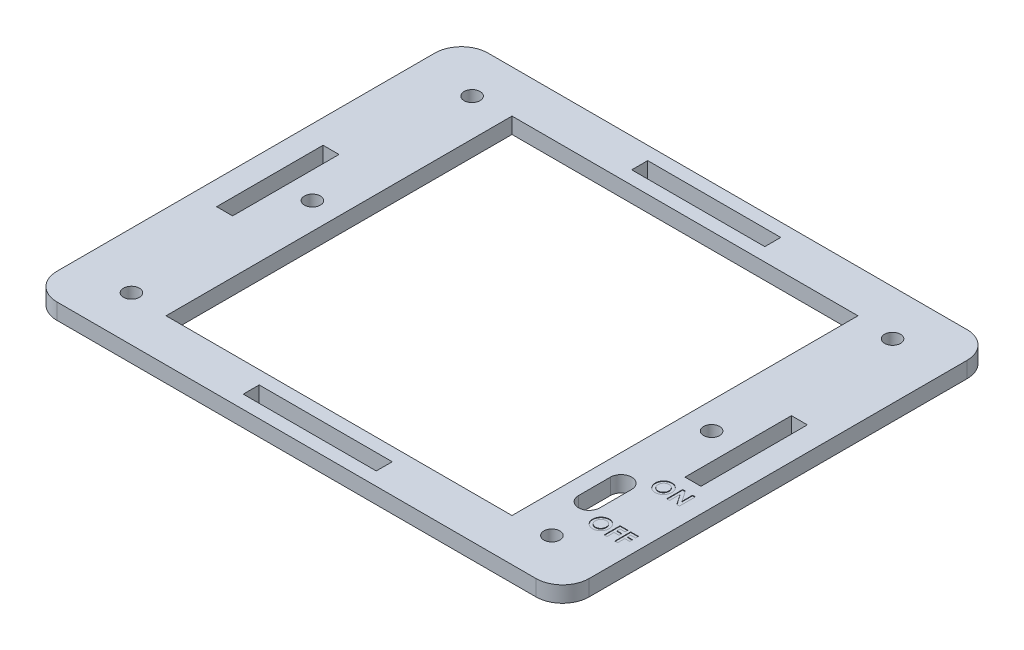
from build123d import *

# Parameters (mm, degrees)
SKETCH1_W           = 100
SKETCH1_H           = 81
BOSS_EXTRUDE1_DEPTH = 3
FILLET1_R           = 5
SKETCH2_R           = 1.5
CUT_EXTRUDE1_DEPTH  = 3
SKETCH3_W           = 25
SKETCH3_H           = 3
SKETCH3_W_2         = 3
SKETCH3_H_2         = 20
CUT_EXTRUDE2_DEPTH  = 10
SKETCH4_W           = 65
SKETCH4_H           = 65
CUT_EXTRUDE3_DEPTH  = 65.414672242
CUT_EXTRUDE4_DEPTH  = 6
SKETCH6_R           = 1.5
CUT_EXTRUDE5_DEPTH  = 3
CUT_EXTRUDE6_DEPTH  = 0.1


with BuildPart() as part:
    # Sketch1 → Boss-Extrude1 (new body)
    with BuildSketch(Plane(origin=(0, 0, 0), x_dir=(1, 0, 0), z_dir=(0, 1, 0))):
        Rectangle(SKETCH1_W, SKETCH1_H)
    extrude(amount=BOSS_EXTRUDE1_DEPTH)

    # Fillet1
    fillet1_edges = [part.edges().sort_by_distance(p)[0] for p in [
        (50, 1.5, 40.5),
        (-50, 1.5, 40.5),
        (-50, 1.5, -40.5),
        (50, 1.5, -40.5),
    ]]
    fillet(fillet1_edges, radius=FILLET1_R)

    # Sketch2 → Cut-Extrude1 (cut)
    with BuildSketch(Plane(origin=(0, 3, 0), x_dir=(1, 0, 0), z_dir=(0, 1, 0))):
        with Locations(Location((39.5, -32, 0), (0, 0, 270))):
            Circle(SKETCH2_R)
        with Locations(Location((39.5, 32, 0), (0, 0, 270))):
            Circle(SKETCH2_R)
        with Locations(Location((-39.5, 32, 0), (0, 0, 270))):
            Circle(SKETCH2_R)
        with Locations(Location((-39.5, -32, 0), (0, 0, 270))):
            Circle(SKETCH2_R)
    extrude(amount=-CUT_EXTRUDE1_DEPTH, mode=Mode.SUBTRACT)

    # Sketch3 → Cut-Extrude2 (cut)
    with BuildSketch(Plane(origin=(0, 3, 0), x_dir=(1, 0, 0), z_dir=(0, 1, 0))):
        with Locations((0, -36.5)):
            Rectangle(SKETCH3_W, SKETCH3_H)
        with Locations((0, 36.5)):
            Rectangle(SKETCH3_W, SKETCH3_H)
        with Locations((44, 0)):
            Rectangle(SKETCH3_W_2, SKETCH3_H_2)
        with Locations((-44, 0)):
            Rectangle(SKETCH3_W_2, SKETCH3_H_2)
    extrude(amount=-CUT_EXTRUDE2_DEPTH, mode=Mode.SUBTRACT)

    # Sketch4 → Cut-Extrude3 (cut, through all)
    with BuildSketch(Plane(origin=(0, 3, 0), x_dir=(1, 0, 0), z_dir=(0, 1, 0))):
        Rectangle(SKETCH4_W, SKETCH4_H)
    extrude(amount=-CUT_EXTRUDE3_DEPTH, mode=Mode.SUBTRACT)

    # Sketch5 → Cut-Extrude4 (cut)
    with BuildSketch(Plane(origin=(0, 3, 0), x_dir=(1, 0, 0), z_dir=(0, 1, 0))):
        with BuildLine():
            Line((39.5, -17), (39.5, -23))
            ThreePointArc((39.5, -23), (37.5, -25), (35.5, -23))
            Line((35.5, -23), (35.5, -17))
            ThreePointArc((35.5, -17), (37.5, -15), (39.5, -17))
        make_face()
    extrude(amount=-CUT_EXTRUDE4_DEPTH, mode=Mode.SUBTRACT)

    # Sketch6 → Cut-Extrude5 (cut)
    with BuildSketch(Plane(origin=(0, 3, 0), x_dir=(1, 0, 0), z_dir=(0, 1, 0))):
        with Locations(Location((-37.5, 0, 0), (0, 0, 270))):
            Circle(SKETCH6_R)
        with Locations(Location((37.5, 0, 0), (0, 0, 270))):
            Circle(SKETCH6_R)
    extrude(amount=-CUT_EXTRUDE5_DEPTH, mode=Mode.SUBTRACT)

    # Sketch7 → Cut-Extrude6 (cut)
    # profile 1 of 5: a face of its own
    with BuildSketch(Plane(origin=(0, 3, 0), x_dir=(1, 0, 0), z_dir=(0, 1, 0))):
        with BuildLine():
            add(Edge.make_bspline(
                [(42.221556265, -12.162235324), (42.273714942, -12.163585806), (42.376687983, -12.166251962), (42.528124168, -12.188476457), (42.674060933, -12.224688085), (42.814432285, -12.275024867), (42.948886751, -12.340850179), (43.077898596, -12.420297831), (43.201005707, -12.514867348), (43.316946581, -12.622352581), (43.424096858, -12.739238078), (43.516942636, -12.865086097), (43.59611811, -12.996635788), (43.661738954, -13.134239643), (43.711721441, -13.278850633), (43.746796219, -13.429731436), (43.769330026, -13.586839125), (43.771921761, -13.693808047), (43.773238957, -13.748172824)],
                knots=[0, 0, 0, 0, 1.014329547, 2.002516266, 2.970391464, 3.935626869, 4.897733899, 5.877609409, 6.878433252, 7.912639331, 8.949961323, 9.958554974, 10.949718813, 11.932905612, 12.9188844, 13.919928257, 14.942845884, 16, 16, 16, 16], degree=3))
            add(Edge.make_bspline(
                [(43.773238957, -13.748172824), (43.7718362, -13.801925036), (43.769072022, -13.907845493), (43.747716148, -14.063505373), (43.712050706, -14.212769927), (43.662915961, -14.35597702), (43.598485231, -14.492433004), (43.520853765, -14.623009134), (43.427973018, -14.74649363), (43.323230714, -14.862820226), (43.207918527, -14.968411574), (43.085784616, -15.061463766), (42.957392919, -15.140312683), (42.822931361, -15.204922206), (42.682111596, -15.255063278), (42.535281464, -15.290441448), (42.382450054, -15.311941476), (42.278517283, -15.314687599), (42.225762996, -15.316081478)],
                knots=[0, 0, 0, 0, 1.051557043, 2.072126891, 3.067553643, 4.050577992, 5.02905126, 6.015227836, 7.017913613, 8.04756643, 9.074058332, 10.072836633, 11.047628519, 12.017157415, 12.98668631, 13.966869689, 14.968021931, 16, 16, 16, 16], degree=3))
            add(Edge.make_bspline(
                [(42.225762996, -15.316081478), (42.170588337, -15.314831099), (42.062177674, -15.312374277), (41.903518184, -15.289011014), (41.751508683, -15.25381778), (41.607426138, -15.201293766), (41.469803193, -15.135634331), (41.339651002, -15.054770801), (41.217013307, -14.958836808), (41.102593576, -14.850289259), (40.998929024, -14.731514431), (40.907424722, -14.606039359), (40.830238813, -14.474822561), (40.767368474, -14.337802624), (40.717804024, -14.195831096), (40.682841936, -14.048043328), (40.662188997, -13.894793768), (40.659312162, -13.790703603), (40.657854342, -13.737956478)],
                knots=[0, 0, 0, 0, 1.067978421, 2.098431617, 3.099715153, 4.085208694, 5.062210972, 6.048429807, 7.046490867, 8.072918869, 9.098532598, 10.095778865, 11.076610158, 12.041847152, 13.011192615, 13.984257998, 14.978533688, 16, 16, 16, 16], degree=3))
            add(Edge.make_bspline(
                [(40.657854342, -13.737956478), (40.65831189, -13.702470973), (40.659221192, -13.631949292), (40.670174697, -13.527439759), (40.685944595, -13.424970113), (40.709267526, -13.3249489), (40.737598925, -13.226670518), (40.774306256, -13.131049766), (40.816089132, -13.037065151), (40.864908488, -12.94582675), (40.919190892, -12.858174032), (40.978417827, -12.77452047), (41.04273822, -12.695877558), (41.111944872, -12.621728487), (41.18627628, -12.552560645), (41.264754689, -12.487394864), (41.348902126, -12.42796218), (41.436876865, -12.372811126), (41.528182926, -12.322938986), (41.622448611, -12.280489311), (41.717731859, -12.243418733), (41.815305527, -12.214160993), (41.91412394, -12.190330871), (42.015242771, -12.174571602), (42.11774847, -12.1636184), (42.186871548, -12.162697444), (42.221556265, -12.162235324)],
                knots=[0, 0, 0, 0, 1.034744296, 2.056386356, 3.06226378, 4.057406941, 5.050368692, 6.043467995, 7.042652155, 8.049140477, 9.059438543, 10.048523776, 11.036952808, 12.020949711, 13.004946614, 13.997082645, 14.994316842, 16.007702937, 17.024872941, 18.026463647, 19.021641123, 20.005082605, 20.995858141, 21.984425357, 22.988620895, 24, 24, 24, 24], degree=3))
        make_face()
        with BuildLine():
            add(Edge.make_bspline(
                [(42.213142803, -12.700696862), (42.178040021, -12.701638749), (42.108761175, -12.703497656), (42.007141725, -12.717660013), (41.909583464, -12.740278907), (41.816627197, -12.773042098), (41.727870042, -12.814741325), (41.643154662, -12.865230886), (41.563654187, -12.926246303), (41.488308558, -12.994511931), (41.42024618, -13.070575528), (41.360110922, -13.152090608), (41.309787397, -13.238921043), (41.26764113, -13.330260197), (41.235914331, -13.427135157), (41.213316284, -13.528787089), (41.199035162, -13.635391145), (41.197235008, -13.708062992), (41.19631588, -13.745168016)],
                knots=[0, 0, 0, 0, 1.033739768, 2.040188636, 3.016340934, 3.979330865, 4.937572243, 5.900995986, 6.878200029, 7.884839167, 8.891893314, 9.879764717, 10.863503415, 11.843163062, 12.837761627, 13.859916423, 14.907309254, 16, 16, 16, 16], degree=3))
            add(Edge.make_bspline(
                [(41.19631588, -13.745168016), (41.197534504, -13.78628873), (41.199922804, -13.866878516), (41.216727173, -13.984440725), (41.245477776, -14.095466563), (41.286993087, -14.19941302), (41.338482965, -14.297434343), (41.402425222, -14.388329141), (41.477784295, -14.472641651), (41.535840315, -14.521866805), (41.565306265, -14.546850709)],
                knots=[0, 0, 0, 0, 1.078454662, 2.113592447, 3.107694534, 4.079536787, 5.043276885, 6.005368276, 6.987637804, 8, 8, 8, 8], degree=3))
            add(Edge.make_bspline(
                [(41.565306265, -14.546850709), (41.589444504, -14.565307857), (41.637177143, -14.60180631), (41.713368826, -14.648586566), (41.791831258, -14.688681912), (41.873156534, -14.721078477), (41.957172901, -14.74656107), (42.043868837, -14.764406111), (42.133121502, -14.775605418), (42.193478336, -14.776943947), (42.223960111, -14.777619939)],
                knots=[0, 0, 0, 0, 1.023928204, 2.024787132, 3.009472467, 3.9914905, 4.972207045, 5.96565515, 6.972602802, 8, 8, 8, 8], degree=3))
            add(Edge.make_bspline(
                [(42.223960111, -14.777619939), (42.2584593, -14.776670067), (42.32633754, -14.774801162), (42.426065289, -14.760813152), (42.521607502, -14.737140388), (42.613557312, -14.704664607), (42.701649578, -14.662441809), (42.785453768, -14.610386221), (42.865116815, -14.549137016), (42.940366455, -14.479974911), (43.009148183, -14.403611676), (43.069157951, -14.321661803), (43.121081513, -14.235930892), (43.162351348, -14.145205554), (43.195331601, -14.050342191), (43.217657669, -13.950920676), (43.232059434, -13.847350861), (43.233860095, -13.776867942), (43.234777419, -13.740961285)],
                knots=[0, 0, 0, 0, 1.026359118, 2.019393844, 2.989460624, 3.950973911, 4.916101784, 5.890408035, 6.881132271, 7.902007068, 8.92769091, 9.933912415, 10.920395702, 11.90457117, 12.894218921, 13.903490204, 14.931958862, 16, 16, 16, 16], degree=3))
            add(Edge.make_bspline(
                [(43.234777419, -13.740961285), (43.233828355, -13.705261102), (43.231960268, -13.634990736), (43.217947637, -13.531687198), (43.194424999, -13.4327046), (43.161851697, -13.337881292), (43.120257315, -13.247124312), (43.068821641, -13.160752815), (43.007725158, -13.078850302), (42.938373998, -13.001974907), (42.862889521, -12.931331343), (42.781849394, -12.870025571), (42.697521209, -12.816752804), (42.607970066, -12.77502107), (42.515028107, -12.741773486), (42.418128195, -12.717289488), (42.316903316, -12.703597147), (42.248037938, -12.701672241), (42.213142803, -12.700696862)],
                knots=[0, 0, 0, 0, 1.055025985, 2.07665775, 3.074803781, 4.057872707, 5.035505728, 6.020516407, 7.023567878, 8.050795229, 9.077271434, 10.074415901, 11.050397877, 12.019801805, 12.988065821, 13.964604439, 14.968634123, 16, 16, 16, 16], degree=3))
        make_face(mode=Mode.SUBTRACT)
    # profile 2 of 5: a face of its own
    with BuildSketch(Plane(origin=(0, 3, 0), x_dir=(1, 0, 0), z_dir=(0, 1, 0))):
        Polygon((44.311700496, -12.239158401), (44.796676457, -12.239158401), (46.157854342, -14.213317055), (46.157854342, -12.239158401), (46.69631588, -12.239158401), (46.69631588, -15.239158401), (46.20773415, -15.239158401), (44.850162034, -13.271009362), (44.850162034, -15.239158401), (44.311700496, -15.239158401), align=None)
    # profile 3 of 5: a face of its own
    with BuildSketch(Plane(origin=(0, 3, 0), x_dir=(1, 0, 0), z_dir=(0, 1, 0))):
        with BuildLine():
            add(Edge.make_bspline(
                [(42.221556265, -23.931466093), (42.273714942, -23.932816575), (42.376687983, -23.935482731), (42.528124168, -23.957707226), (42.674060933, -23.993918854), (42.814432285, -24.044255636), (42.948886751, -24.110080949), (43.077898596, -24.1895286), (43.201005707, -24.284098118), (43.316946581, -24.39158335), (43.424096858, -24.508468848), (43.516942636, -24.634316866), (43.59611811, -24.765866557), (43.661738954, -24.903470412), (43.711721441, -25.048081403), (43.746796219, -25.198962205), (43.769330026, -25.356069894), (43.771921761, -25.463038816), (43.773238957, -25.517403593)],
                knots=[0, 0, 0, 0, 1.014329547, 2.002516266, 2.970391464, 3.935626869, 4.897733899, 5.877609409, 6.878433252, 7.912639331, 8.949961323, 9.958554974, 10.949718813, 11.932905612, 12.9188844, 13.919928257, 14.942845884, 16, 16, 16, 16], degree=3))
            add(Edge.make_bspline(
                [(43.773238957, -25.517403593), (43.7718362, -25.571155805), (43.769072022, -25.677076262), (43.747716148, -25.832736142), (43.712050706, -25.982000696), (43.662915961, -26.125207789), (43.598485231, -26.261663774), (43.520853765, -26.392239903), (43.427973018, -26.515724399), (43.323230714, -26.632050996), (43.207918527, -26.737642343), (43.085784616, -26.830694536), (42.957392919, -26.909543452), (42.822931361, -26.974152976), (42.682111596, -27.024294048), (42.535281464, -27.059672217), (42.382450054, -27.081172245), (42.278517283, -27.083918368), (42.225762996, -27.085312247)],
                knots=[0, 0, 0, 0, 1.051557043, 2.072126891, 3.067553643, 4.050577992, 5.02905126, 6.015227836, 7.017913613, 8.04756643, 9.074058332, 10.072836633, 11.047628519, 12.017157415, 12.98668631, 13.966869689, 14.968021931, 16, 16, 16, 16], degree=3))
            add(Edge.make_bspline(
                [(42.225762996, -27.085312247), (42.170588337, -27.084061869), (42.062177674, -27.081605046), (41.903518184, -27.058241784), (41.751508683, -27.023048549), (41.607426138, -26.970524535), (41.469803193, -26.9048651), (41.339651002, -26.82400157), (41.217013307, -26.728067578), (41.102593576, -26.619520028), (40.998929024, -26.5007452), (40.907424722, -26.375270128), (40.830238813, -26.24405333), (40.767368474, -26.107033394), (40.717804024, -25.965061865), (40.682841936, -25.817274097), (40.662188997, -25.664024537), (40.659312162, -25.559934373), (40.657854342, -25.507187247)],
                knots=[0, 0, 0, 0, 1.067978421, 2.098431617, 3.099715153, 4.085208694, 5.062210972, 6.048429807, 7.046490867, 8.072918869, 9.098532598, 10.095778865, 11.076610158, 12.041847152, 13.011192615, 13.984257998, 14.978533688, 16, 16, 16, 16], degree=3))
            add(Edge.make_bspline(
                [(40.657854342, -25.507187247), (40.65831189, -25.471701742), (40.659221192, -25.401180061), (40.670174697, -25.296670528), (40.685944595, -25.194200882), (40.709267526, -25.094179669), (40.737598925, -24.995901287), (40.774306256, -24.900280535), (40.816089132, -24.80629592), (40.864908488, -24.715057519), (40.919190892, -24.627404801), (40.978417827, -24.543751239), (41.04273822, -24.465108327), (41.111944872, -24.390959257), (41.18627628, -24.321791414), (41.264754689, -24.256625634), (41.348902126, -24.197192949), (41.436876865, -24.142041896), (41.528182926, -24.092169755), (41.622448611, -24.04972008), (41.717731859, -24.012649502), (41.815305527, -23.983391763), (41.91412394, -23.95956164), (42.015242771, -23.943802371), (42.11774847, -23.93284917), (42.186871548, -23.931928213), (42.221556265, -23.931466093)],
                knots=[0, 0, 0, 0, 1.034744296, 2.056386356, 3.06226378, 4.057406941, 5.050368692, 6.043467995, 7.042652155, 8.049140477, 9.059438543, 10.048523776, 11.036952808, 12.020949711, 13.004946614, 13.997082645, 14.994316842, 16.007702937, 17.024872941, 18.026463647, 19.021641123, 20.005082605, 20.995858141, 21.984425357, 22.988620895, 24, 24, 24, 24], degree=3))
        make_face()
        with BuildLine():
            add(Edge.make_bspline(
                [(42.213142803, -24.469927632), (42.178040021, -24.470869518), (42.108761175, -24.472728425), (42.007141725, -24.486890782), (41.909583464, -24.509509676), (41.816627197, -24.542272867), (41.727870042, -24.583972095), (41.643154662, -24.634461656), (41.563654187, -24.695477073), (41.488308558, -24.7637427), (41.42024618, -24.839806297), (41.360110922, -24.921321377), (41.309787397, -25.008151812), (41.26764113, -25.099490967), (41.235914331, -25.196365926), (41.213316284, -25.298017858), (41.199035162, -25.404621914), (41.197235008, -25.477293761), (41.19631588, -25.514398785)],
                knots=[0, 0, 0, 0, 1.033739768, 2.040188636, 3.016340934, 3.979330865, 4.937572243, 5.900995986, 6.878200029, 7.884839167, 8.891893314, 9.879764717, 10.863503415, 11.843163062, 12.837761627, 13.859916423, 14.907309254, 16, 16, 16, 16], degree=3))
            add(Edge.make_bspline(
                [(41.19631588, -25.514398785), (41.197534504, -25.5555195), (41.199922804, -25.636109286), (41.216727173, -25.753671494), (41.245477776, -25.864697332), (41.286993087, -25.968643789), (41.338482965, -26.066665112), (41.402425222, -26.15755991), (41.477784295, -26.24187242), (41.535840315, -26.291097575), (41.565306265, -26.316081478)],
                knots=[0, 0, 0, 0, 1.078454662, 2.113592447, 3.107694534, 4.079536787, 5.043276885, 6.005368276, 6.987637804, 8, 8, 8, 8], degree=3))
            add(Edge.make_bspline(
                [(41.565306265, -26.316081478), (41.589444504, -26.334538626), (41.637177143, -26.371037079), (41.713368826, -26.417817335), (41.791831258, -26.457912681), (41.873156534, -26.490309246), (41.957172901, -26.515791839), (42.043868837, -26.53363688), (42.133121502, -26.544836187), (42.193478336, -26.546174716), (42.223960111, -26.546850709)],
                knots=[0, 0, 0, 0, 1.023928204, 2.024787132, 3.009472467, 3.9914905, 4.972207045, 5.96565515, 6.972602802, 8, 8, 8, 8], degree=3))
            add(Edge.make_bspline(
                [(42.223960111, -26.546850709), (42.2584593, -26.545900836), (42.32633754, -26.544031932), (42.426065289, -26.530043921), (42.521607502, -26.506371157), (42.613557312, -26.473895376), (42.701649578, -26.431672579), (42.785453768, -26.37961699), (42.865116815, -26.318367785), (42.940366455, -26.24920568), (43.009148183, -26.172842445), (43.069157951, -26.090892572), (43.121081513, -26.005161662), (43.162351348, -25.914436323), (43.195331601, -25.81957296), (43.217657669, -25.720151445), (43.232059434, -25.61658163), (43.233860095, -25.546098711), (43.234777419, -25.510192055)],
                knots=[0, 0, 0, 0, 1.026359118, 2.019393844, 2.989460624, 3.950973911, 4.916101784, 5.890408035, 6.881132271, 7.902007068, 8.92769091, 9.933912415, 10.920395702, 11.90457117, 12.894218921, 13.903490204, 14.931958862, 16, 16, 16, 16], degree=3))
            add(Edge.make_bspline(
                [(43.234777419, -25.510192055), (43.233828355, -25.474491871), (43.231960268, -25.404221505), (43.217947637, -25.300917967), (43.194424999, -25.201935369), (43.161851697, -25.107112061), (43.120257315, -25.016355081), (43.068821641, -24.929983584), (43.007725158, -24.848081071), (42.938373998, -24.771205676), (42.862889521, -24.700562112), (42.781849394, -24.63925634), (42.697521209, -24.585983573), (42.607970066, -24.544251839), (42.515028107, -24.511004255), (42.418128195, -24.486520257), (42.316903316, -24.472827916), (42.248037938, -24.470903011), (42.213142803, -24.469927632)],
                knots=[0, 0, 0, 0, 1.055025985, 2.07665775, 3.074803781, 4.057872707, 5.035505728, 6.020516407, 7.023567878, 8.050795229, 9.077271434, 10.074415901, 11.050397877, 12.019801805, 12.988065821, 13.964604439, 14.968634123, 16, 16, 16, 16], degree=3))
        make_face(mode=Mode.SUBTRACT)
    # profile 4 of 5: a face of its own
    with BuildSketch(Plane(origin=(0, 3, 0), x_dir=(1, 0, 0), z_dir=(0, 1, 0))):
        Polygon((44.311700496, -24.00838917), (45.773238957, -24.00838917), (45.773238957, -24.546850709), (44.850162034, -24.546850709), (44.850162034, -25.123773785), (45.773238957, -25.123773785), (45.773238957, -25.662235324), (44.850162034, -25.662235324), (44.850162034, -27.00838917), (44.311700496, -27.00838917), align=None)
    # profile 5 of 5: a face of its own
    with BuildSketch(Plane(origin=(0, 3, 0), x_dir=(1, 0, 0), z_dir=(0, 1, 0))):
        Polygon((46.311700496, -24.00838917), (47.773238957, -24.00838917), (47.773238957, -24.546850709), (46.850162034, -24.546850709), (46.850162034, -25.123773785), (47.773238957, -25.123773785), (47.773238957, -25.662235324), (46.850162034, -25.662235324), (46.850162034, -27.00838917), (46.311700496, -27.00838917), align=None)
    extrude(amount=-CUT_EXTRUDE6_DEPTH, mode=Mode.SUBTRACT)


solid = part.part
